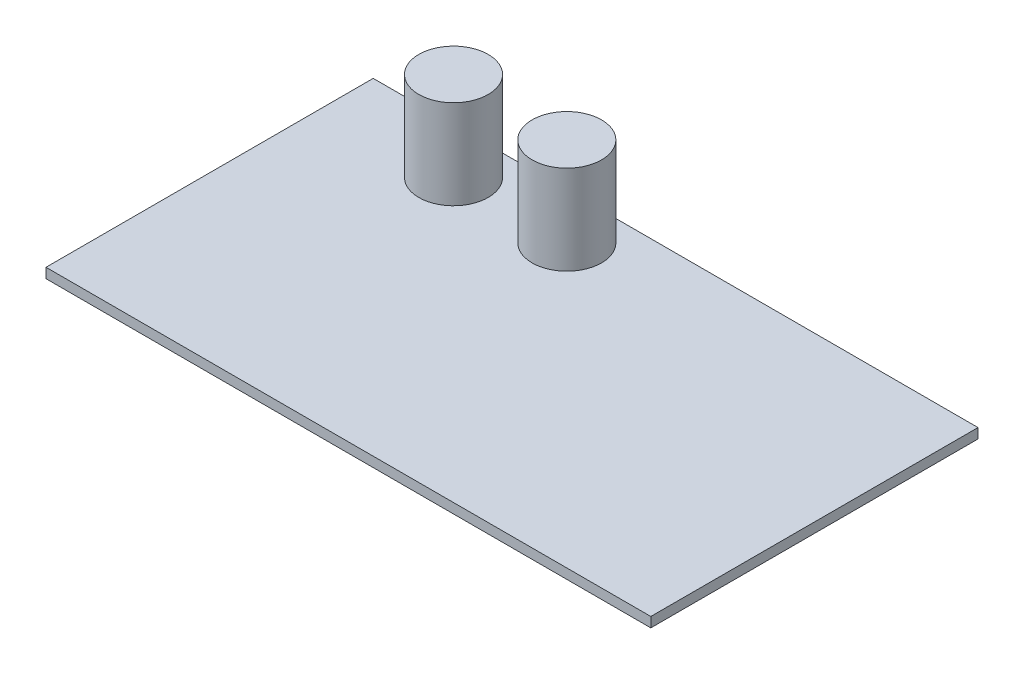
from build123d import *

# Parameters (mm, degrees)
SKETCH1_W           = 61
SKETCH1_H           = 33
BOSS_EXTRUDE1_DEPTH = 1
SKETCH2_R           = 3.5
BOSS_EXTRUDE2_DEPTH = 9


with BuildPart() as part:
    # Sketch1 → Boss-Extrude1 (new body)
    with BuildSketch(Plane(origin=(0, 0, 0), x_dir=(1, 0, 0), z_dir=(0, 1, 0))):
        Rectangle(SKETCH1_W, SKETCH1_H)
    extrude(amount=BOSS_EXTRUDE1_DEPTH)

    # Sketch2 → Boss-Extrude2 (add)
    with BuildSketch(Plane(origin=(0, 1, 0), x_dir=(1, 0, 0), z_dir=(0, 1, 0))):
        with Locations(Location((-17.793169793, 11.893004115, 0), (0, 0, 270))):
            Circle(SKETCH2_R)
        with Locations(Location((-6.363529475, 11.893004115, 0), (0, 0, 270))):
            Circle(SKETCH2_R)
    extrude(amount=BOSS_EXTRUDE2_DEPTH)


solid = part.part
